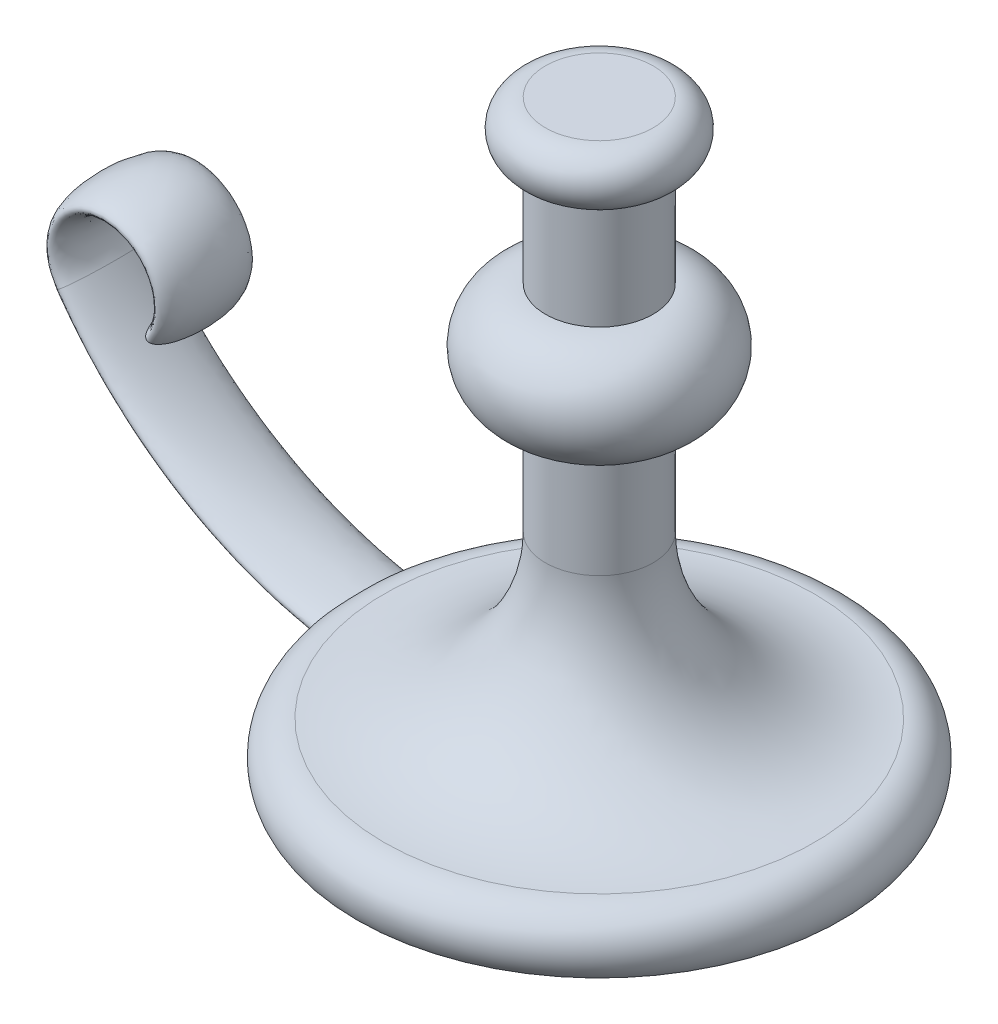
from build123d import *

# Parameters (mm, degrees)
SKETCH3_RX = 17.5
SKETCH3_RY = 5


with BuildPart() as part:
    # Sketch1 → Revolve1 (revolve)
    with BuildSketch(Plane.XY, mode=Mode.PRIVATE) as revolve1_sk:
        with BuildLine():
            Line((0, 0), (90, 0))
            ThreePointArc((90, 0), (91.180339887, 13.090169944), (80, 20))
            ThreePointArc((80, 20), (37.573593129, 37.573593129), (20, 80))
            Line((20, 80), (20, 120))
            ThreePointArc((20, 120), (40, 140), (20, 160))
            Line((20, 160), (20, 200))
            ThreePointArc((20, 200), (30, 210), (20, 220))
            Line((20, 220), (0, 220))
            Line((0, 220), (0, 0))
        make_face()
    revolve(revolve1_sk.sketch.rotate(Axis((0, 0, 0), (0, 1, 0)), 90), axis=Axis((0, 0, 0), (0, 1, 0)))

    # Sweep1: sweep along a path in Sketch2
    with BuildLine(Plane.XY) as sweep1_path:
        Line((0, 10), (-60, 10))
        ThreePointArc((-60, 10), (-129.821200219, 27.240819526), (-183.592070943, 75))
        ThreePointArc((-183.592070943, 75), (-167.113128151, 106.333333333), (-150.634185358, 75))
    # Sketch3 → Sweep1 (sweep)
    with BuildSketch(Plane(origin=(0, 0, 0), x_dir=(0, 0, -1), z_dir=(1, 0, 0))):
        with Locations((0, 10)):
            Ellipse(SKETCH3_RX, SKETCH3_RY)
    sweep(path=sweep1_path.line)


solid = part.part
